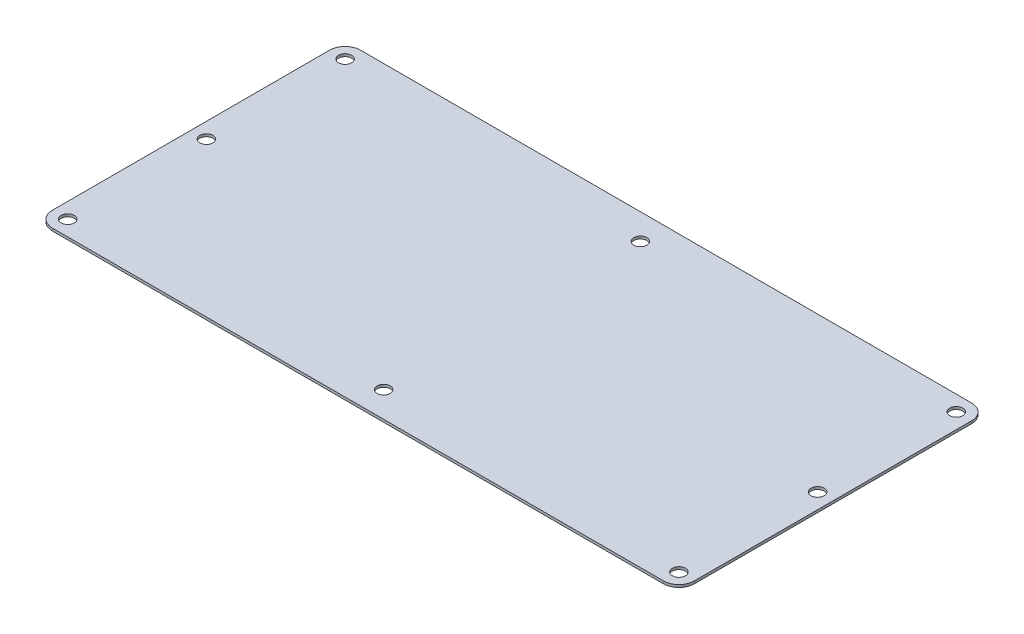
from build123d import *

# Parameters (mm, degrees)
SKETCH_1_R      = 2.55
EXTRUDE_1_DEPTH = 1


with BuildPart() as part:
    # 草图1 → 凸台-拉伸1 (new body)
    with BuildSketch(Plane(origin=(0, 0, 0), x_dir=(1, 0, 0), z_dir=(0, 1, 0))):
        with BuildLine():
            Line((30.343570916, 133.137110586), (268.343570916, 133.137110586))
            ThreePointArc((268.343570916, 133.137110586), (272.586211603, 131.379751274), (274.343570916, 127.137110586))
            Line((274.343570916, 127.137110586), (274.343570916, 19.137110586))
            ThreePointArc((274.343570916, 19.137110586), (272.586211603, 14.894469899), (268.343570916, 13.137110586))
            Line((268.343570916, 13.137110586), (30.343570916, 13.137110586))
            ThreePointArc((30.343570916, 13.137110586), (26.100930228, 14.894469899), (24.343570916, 19.137110586))
            Line((24.343570916, 19.137110586), (24.343570916, 127.137110586))
            ThreePointArc((24.343570916, 127.137110586), (26.100930228, 131.379751274), (30.343570916, 133.137110586))
        make_face()
        with Locations(Location((30.343570916, 127.137110586, 0), (0, 0, 270))):
            Circle(SKETCH_1_R, mode=Mode.SUBTRACT)
        with Locations(Location((268.343570916, 127.137110586, 0), (0, 0, 270))):
            Circle(SKETCH_1_R, mode=Mode.SUBTRACT)
        with Locations(Location((149.343570916, 123.137110586, 0), (0, 0, 270))):
            Circle(SKETCH_1_R, mode=Mode.SUBTRACT)
        with Locations(Location((30.343570916, 19.137110586, 0), (0, 0, 270))):
            Circle(SKETCH_1_R, mode=Mode.SUBTRACT)
        with Locations(Location((268.343570916, 19.137110586, 0), (0, 0, 270))):
            Circle(SKETCH_1_R, mode=Mode.SUBTRACT)
        with Locations(Location((149.343570916, 23.137110586, 0), (0, 0, 270))):
            Circle(SKETCH_1_R, mode=Mode.SUBTRACT)
        with Locations(Location((268.343570916, 73.137110586, 0), (0, 0, 270))):
            Circle(SKETCH_1_R, mode=Mode.SUBTRACT)
        with Locations(Location((30.343570916, 73.137110586, 0), (0, 0, 270))):
            Circle(SKETCH_1_R, mode=Mode.SUBTRACT)
    extrude(amount=EXTRUDE_1_DEPTH)


solid = part.part
